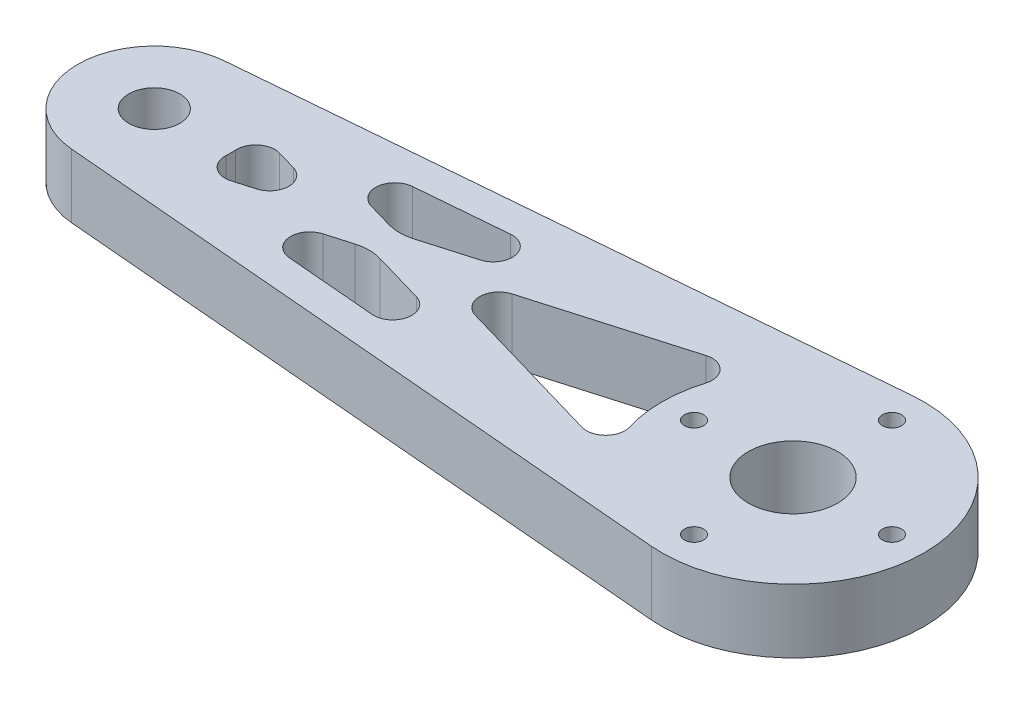
from build123d import *

# Parameters (mm, degrees)
SKETCH1_R           = 7
SKETCH1_R_2         = 4
BOSS_EXTRUDE1_DEPTH = 10
SKETCH2_R           = 1.5
CUT_EXTRUDE1_DEPTH  = 10


with BuildPart() as part:
    # Sketch1 → Boss-Extrude1 (new body)
    with BuildSketch(Plane(origin=(0, 0, 0), x_dir=(1, 0, 0), z_dir=(0, 1, 0))):
        with BuildLine():
            Line((-1.7425, -20.4258095), (-101.02, -11.956571415))
            ThreePointArc((-101.02, -11.956571415), (-112, 0), (-101.02, 11.956571415))
            Line((-101.02, 11.956571415), (-1.7425, 20.4258095))
            ThreePointArc((-1.7425, 20.4258095), (20.5, 0), (-1.7425, -20.4258095))
        make_face()
        with Locations(Location((0, 0, 0), (0, 0, 270))):
            Circle(SKETCH1_R, mode=Mode.SUBTRACT)
        with Locations(Location((-100, 0, 0), (0, 0, 270))):
            Circle(SKETCH1_R_2, mode=Mode.SUBTRACT)
        with BuildLine():
            Line((-84.191001334, -3.779047898), (-81.096242799, -2.881194367))
            ThreePointArc((-81.096242799, -2.881194367), (-78.932136943, 0), (-81.096242799, 2.881194367))
            Line((-81.096242799, 2.881194367), (-84.191001334, 3.779047898))
            ThreePointArc((-84.191001334, 3.779047898), (-86.899619701, 3.241548046), (-88.021516382, 0.718282824))
            ThreePointArc((-88.021516382, 0.718282824), (-88, 0), (-88.021516382, -0.718282824))
            ThreePointArc((-88.021516382, -0.718282824), (-86.899619701, -3.241548046), (-84.191001334, -3.779047898))
        make_face(mode=Mode.SUBTRACT)
        with BuildLine():
            Line((-69.832249651, -3.778216146), (-65.93770065, -2.648326841))
            ThreePointArc((-65.93770065, -2.648326841), (-63.987280982, -2.371113698), (-62.036861314, -2.648326841))
            Line((-62.036861314, -2.648326841), (-53.969530614, -4.988826518))
            ThreePointArc((-53.969530614, -4.988826518), (-51.855920685, -8.418131938), (-55.060424757, -10.859163739))
            Line((-55.060424757, -10.859163739), (-69.251355507, -9.648553367))
            ThreePointArc((-69.251355507, -9.648553367), (-71.98177462, -6.95483008), (-69.832249651, -3.778216146))
        make_face(mode=Mode.SUBTRACT)
        with BuildLine():
            Line((-46.878319164, -2.881194367), (-23.320026626, -9.715942825))
            ThreePointArc((-23.320026626, -9.715942825), (-20.349346369, -8.942517006), (-19.613817698, -5.962227378))
            ThreePointArc((-19.613817698, -5.962227378), (-20.5, 0), (-19.613817698, 5.962227378))
            ThreePointArc((-19.613817698, 5.962227378), (-20.349346369, 8.942517006), (-23.320026626, 9.715942825))
            Line((-23.320026626, 9.715942825), (-46.878319164, 2.881194367))
            ThreePointArc((-46.878319164, 2.881194367), (-49.042425021, 0), (-46.878319164, -2.881194367))
        make_face(mode=Mode.SUBTRACT)
        with BuildLine():
            Line((-62.036861314, 2.648326841), (-53.969530614, 4.988826518))
            ThreePointArc((-53.969530614, 4.988826518), (-51.855920685, 8.418131938), (-55.060424757, 10.859163739))
            Line((-55.060424757, 10.859163739), (-69.251355507, 9.648553367))
            ThreePointArc((-69.251355507, 9.648553367), (-71.98177462, 6.95483008), (-69.832249651, 3.778216146))
            Line((-69.832249651, 3.778216146), (-65.93770065, 2.648326841))
            ThreePointArc((-65.93770065, 2.648326841), (-63.987280982, 2.371113698), (-62.036861314, 2.648326841))
        make_face(mode=Mode.SUBTRACT)
    extrude(amount=BOSS_EXTRUDE1_DEPTH)

    # Sketch2 → Cut-Extrude1 (cut)
    with BuildSketch(Plane(origin=(0, 10, 0), x_dir=(1, 0, 0), z_dir=(0, 1, 0))):
        with Locations(Location((-15.5, 0, 0), (0, 0, 270))):
            Circle(SKETCH2_R)
        with Locations(Location((0, 15.5, 0), (0, 0, 270))):
            Circle(SKETCH2_R)
        with Locations(Location((15.5, 0, 0), (0, 0, 270))):
            Circle(SKETCH2_R)
        with Locations(Location((0, -15.5, 0), (0, 0, 270))):
            Circle(SKETCH2_R)
    extrude(amount=-CUT_EXTRUDE1_DEPTH, mode=Mode.SUBTRACT)


solid = part.part
